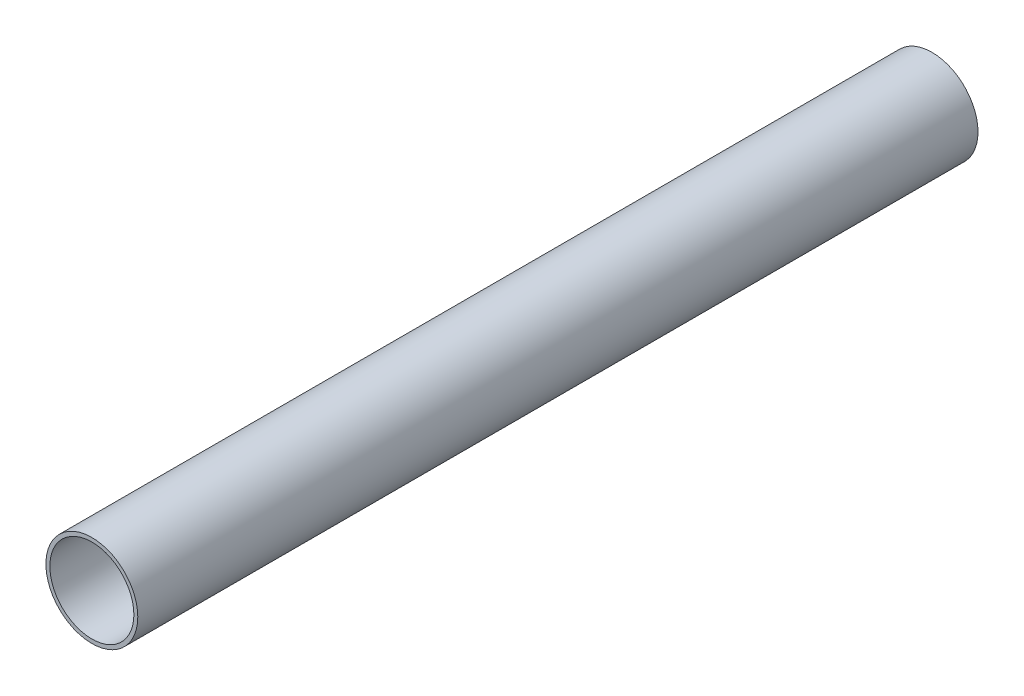
from build123d import *

# Parameters (mm, degrees)
CROQUIS1_R              = 109.35
CROQUIS1_R_2            = 100
SALIENTE_EXTRUIR1_DEPTH = 2000


with BuildPart() as part:
    # Croquis1 → Saliente-Extruir1 (new body)
    with BuildSketch(Plane.XY):
        Circle(CROQUIS1_R)
        Circle(CROQUIS1_R_2, mode=Mode.SUBTRACT)
    extrude(amount=-SALIENTE_EXTRUIR1_DEPTH)


solid = part.part
